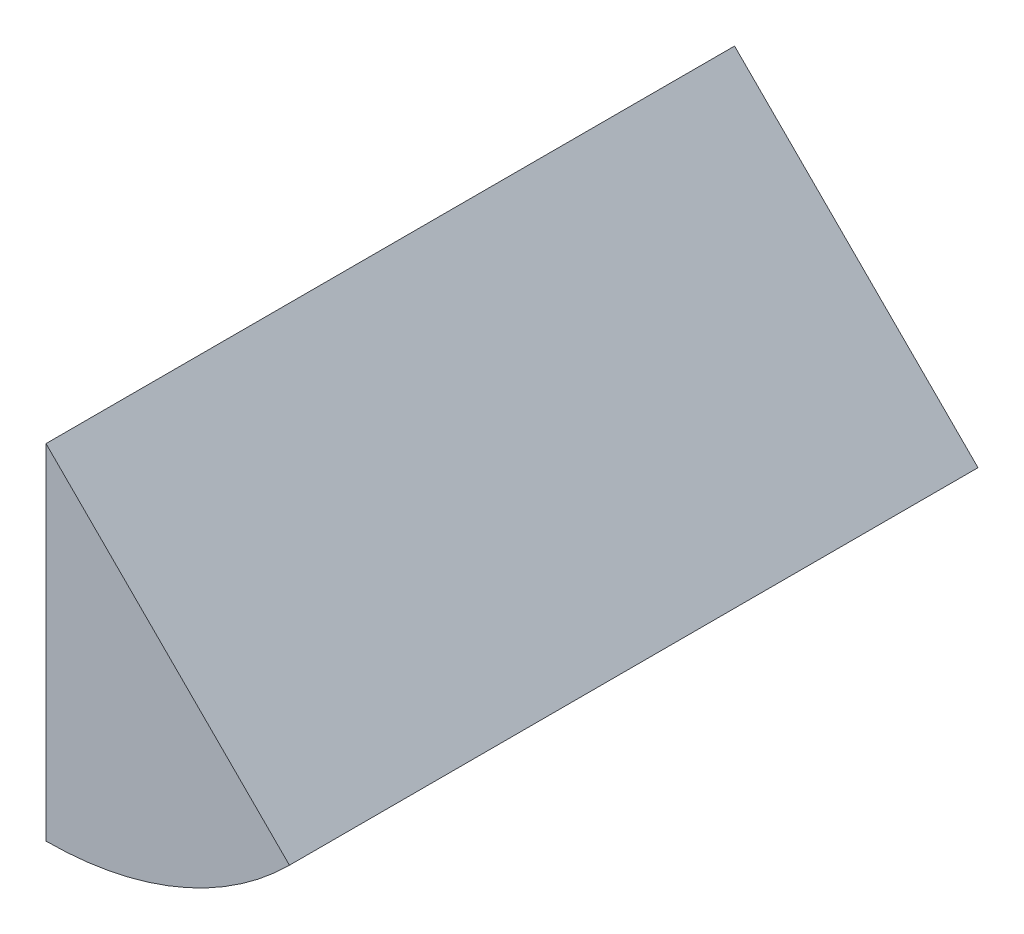
from build123d import *

# Parameters (mm, degrees)
SALIENTE_EXTRUIR1_DEPTH = 50
CROQUIS2_R              = 5
CORTAR_EXTRUIR1_DEPTH   = 10


with BuildPart() as part:
    # Croquis1 → Saliente-Extruir1 (new body)
    with BuildSketch(Plane.XY):
        with BuildLine():
            Line((0, 0), (0, -25))
            ThreePointArc((0, -25), (9.567085809, -23.096988313), (17.67766953, -17.67766953))
            Line((17.67766953, -17.67766953), (0, 0))
        make_face()
    extrude(amount=SALIENTE_EXTRUIR1_DEPTH)

    # Croquis2 → Cortar-Extruir1 (cut)
    with BuildSketch(Plane(origin=(0, 0, 0), x_dir=(-1, 0, 0), z_dir=(0, 0, -1))):
        with Locations((-6.753168062, -16.437204442)):
            Circle(CROQUIS2_R)
    extrude(amount=-CORTAR_EXTRUIR1_DEPTH, mode=Mode.SUBTRACT)


solid = part.part
